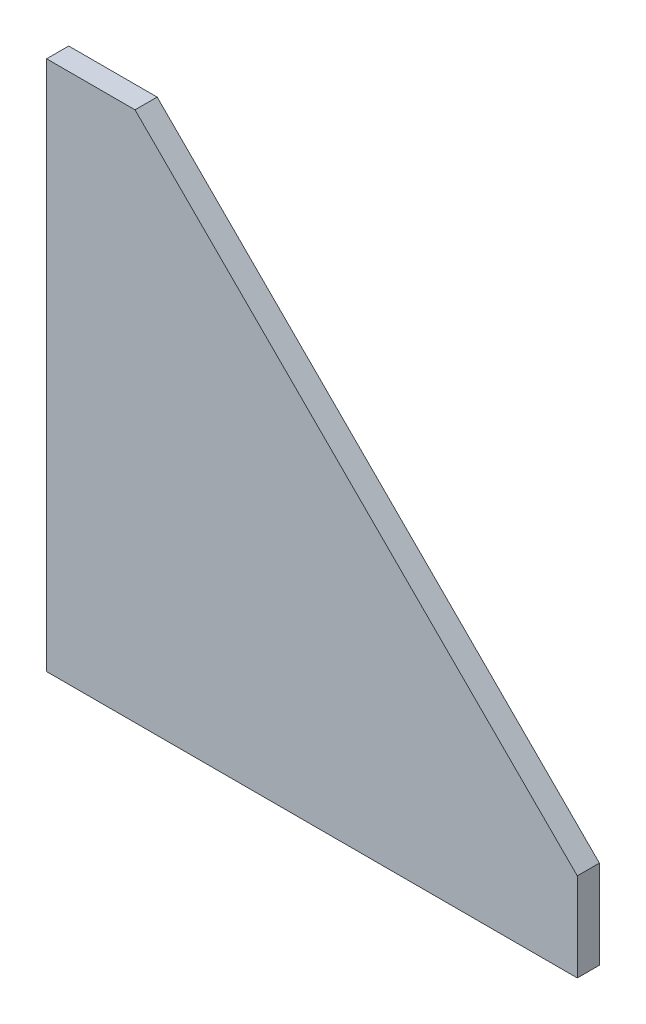
from build123d import *

# Parameters (mm, degrees)
BOSS_EXTRUDE1_DEPTH = 12.7


with BuildPart() as part:
    # Sketch1 → Boss-Extrude1 (new body)
    with BuildSketch(Plane.XY):
        Polygon((0, 0), (0, 304.8), (50.8, 304.8), (304.8, 50.8), (304.8, 0), align=None)
    extrude(amount=BOSS_EXTRUDE1_DEPTH)


solid = part.part
